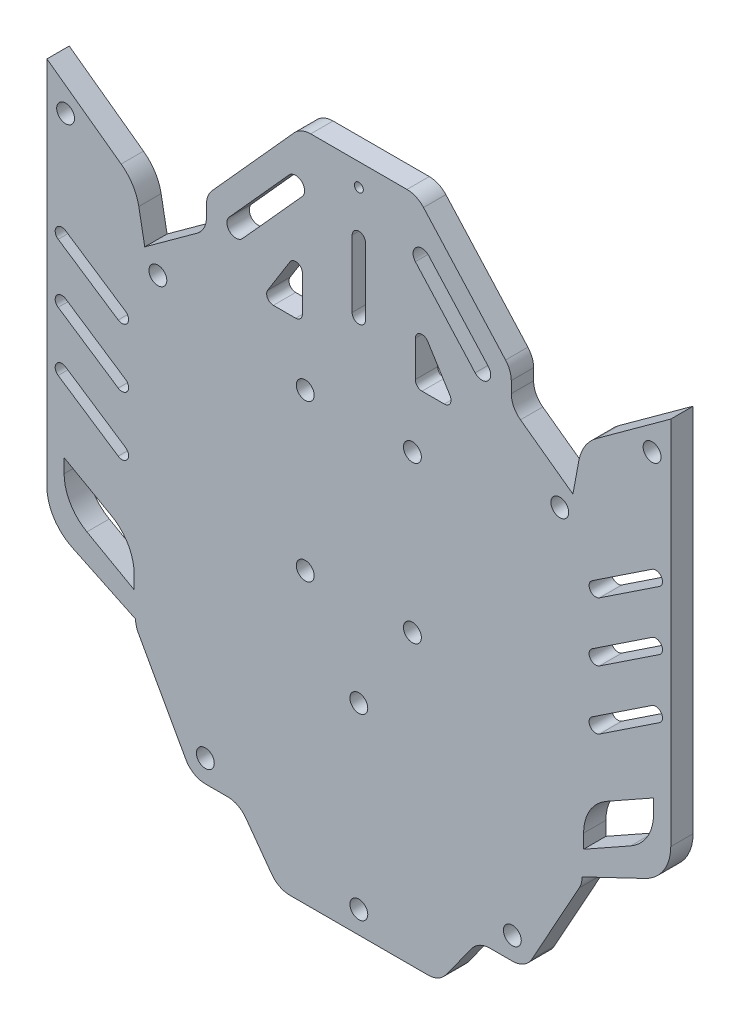
from build123d import *

# Parameters (mm, degrees)
SKETCH2_R           = 1
SKETCH2_R_2         = 2
BOSS_EXTRUDE2_DEPTH = 5


with BuildPart() as part:
    # Sketch2 → Boss-Extrude2 (new body)
    with BuildSketch(Plane.XY):
        with BuildLine():
            Line((10.773856573, 0), (-10.773856573, 0))
            ThreePointArc((-10.773856573, 0), (-12.807539789, -0.432272712), (-14.489580701, -1.654346968))
            Line((-14.489580701, -1.654346968), (-32.85230533, -22.048218747))
            ThreePointArc((-32.85230533, -22.048218747), (-33.804483335, -23.602032031), (-34.136581202, -25.393871779))
            Line((-34.136581202, -25.393871779), (-34.136581202, -27.926924356))
            ThreePointArc((-34.136581202, -27.926924356), (-34.681548581, -30.196876855), (-36.197654941, -31.972009328))
            Line((-36.197654941, -31.972009328), (-47.938926261, -40.502542276))
            Line((-47.938926261, -40.502542276), (-49.271172991, -33.33925419))
            ThreePointArc((-49.271172991, -33.33925419), (-50.646968461, -29.828950283), (-53.224733986, -27.077555801))
            Line((-53.224733986, -27.077555801), (-69.848063434, -15))
            Line((-69.848063434, -15), (-69.848063434, -97.913369077))
            ThreePointArc((-69.848063434, -97.913369077), (-68.307820915, -103.245582818), (-64.161562759, -106.935216093))
            Line((-64.161562759, -106.935216093), (-50, -113.7061014))
            ThreePointArc((-50, -113.7061014), (-49.840547901, -114.95873703), (-49.372361591, -116.131478508))
            Line((-49.372361591, -116.131478508), (-38.744938669, -135.290122192))
            ThreePointArc((-38.744938669, -135.290122192), (-36.909614174, -137.173276478), (-34.372577077, -137.864745084))
            Line((-34.372577077, -137.864745084), (-29.364406032, -137.864745084))
            ThreePointArc((-29.364406032, -137.864745084), (-27.094453533, -138.409712463), (-25.31932106, -139.925818823))
            Line((-25.31932106, -139.925818823), (-19.497457724, -147.938926261))
            ThreePointArc((-19.497457724, -147.938926261), (-17.722325251, -149.455032621), (-15.452372753, -150))
            Line((-15.452372753, -150), (15.452372753, -150))
            ThreePointArc((15.452372753, -150), (17.722325251, -149.455032621), (19.497457724, -147.938926261))
            Line((19.497457724, -147.938926261), (25.31932106, -139.925818823))
            ThreePointArc((25.31932106, -139.925818823), (27.094453533, -138.409712463), (29.364406032, -137.864745084))
            Line((29.364406032, -137.864745084), (34.372577077, -137.864745084))
            ThreePointArc((34.372577077, -137.864745084), (36.909614174, -137.173276478), (38.744938669, -135.290122192))
            Line((38.744938669, -135.290122192), (49.372361591, -116.131478508))
            ThreePointArc((49.372361591, -116.131478508), (49.840547901, -114.95873703), (50, -113.7061014))
            Line((50, -113.7061014), (64.161562759, -106.935216093))
            ThreePointArc((64.161562759, -106.935216093), (68.307820915, -103.245582818), (69.848063434, -97.913369077))
            Line((69.848063434, -97.913369077), (69.848063434, -15))
            Line((69.848063434, -15), (53.224733986, -27.077555801))
            ThreePointArc((53.224733986, -27.077555801), (50.646968461, -29.828950283), (49.271172991, -33.33925419))
            Line((49.271172991, -33.33925419), (47.938926261, -40.502542276))
            Line((47.938926261, -40.502542276), (36.197654941, -31.972009328))
            ThreePointArc((36.197654941, -31.972009328), (34.681548581, -30.196876855), (34.136581202, -27.926924356))
            Line((34.136581202, -27.926924356), (34.136581202, -25.393871779))
            ThreePointArc((34.136581202, -25.393871779), (33.804483335, -23.602032031), (32.85230533, -22.048218747))
            Line((32.85230533, -22.048218747), (14.489580701, -1.654346968))
            ThreePointArc((14.489580701, -1.654346968), (12.807539789, -0.432272712), (10.773856573, 0))
        make_face()
        with Locations((0, -5)):
            Circle(SKETCH2_R, mode=Mode.SUBTRACT)
        with Locations((0, -145)):
            Circle(SKETCH2_R_2, mode=Mode.SUBTRACT)
        with Locations((0, -105)):
            Circle(SKETCH2_R_2, mode=Mode.SUBTRACT)
        with Locations((-12, -50.308044585)):
            Circle(SKETCH2_R_2, mode=Mode.SUBTRACT)
        with Locations((12, -50.308044585)):
            Circle(SKETCH2_R_2, mode=Mode.SUBTRACT)
        with Locations((12, -85.308044585)):
            Circle(SKETCH2_R_2, mode=Mode.SUBTRACT)
        with Locations((-12, -85.308044585)):
            Circle(SKETCH2_R_2, mode=Mode.SUBTRACT)
        with Locations((-34.372577077, -132.864745084)):
            Circle(SKETCH2_R_2, mode=Mode.SUBTRACT)
        with Locations((34.372577077, -132.864745084)):
            Circle(SKETCH2_R_2, mode=Mode.SUBTRACT)
        with Locations((-45, -44.547627247)):
            Circle(SKETCH2_R_2, mode=Mode.SUBTRACT)
        with Locations((45, -44.547627247)):
            Circle(SKETCH2_R_2, mode=Mode.SUBTRACT)
        with Locations((-65.664848414, -23.474551604)):
            Circle(SKETCH2_R_2, mode=Mode.SUBTRACT)
        with Locations((65.664848414, -23.474551604)):
            Circle(SKETCH2_R_2, mode=Mode.SUBTRACT)
        with BuildLine():
            Line((-12.660728973, -13.073490301), (-26.043341101, -27.93638681))
            ThreePointArc((-26.043341101, -27.93638681), (-28.867891964, -28.084415248), (-29.015920402, -25.259864385))
            Line((-29.015920402, -25.259864385), (-15.633308275, -10.396967875))
            ThreePointArc((-15.633308275, -10.396967875), (-12.808757412, -10.248939437), (-12.660728973, -13.073490301))
        make_face(mode=Mode.SUBTRACT)
        with BuildLine():
            Line((14.147018624, -37.43638681), (19.147018624, -37.43638681))
            ThreePointArc((19.147018624, -37.43638681), (20.458982346, -36.663539609), (20.41901608, -35.1413884))
            Line((20.41901608, -35.1413884), (15.41901608, -27.1413884))
            ThreePointArc((15.41901608, -27.1413884), (13.733494855, -26.494513691), (12.647018624, -27.93638681))
            Line((12.647018624, -27.93638681), (12.647018624, -35.93638681))
            ThreePointArc((12.647018624, -35.93638681), (13.086358453, -36.997046982), (14.147018624, -37.43638681))
        make_face(mode=Mode.SUBTRACT)
        with BuildLine():
            Line((-14.147018624, -37.43638681), (-19.147018624, -37.43638681))
            ThreePointArc((-19.147018624, -37.43638681), (-20.458982346, -36.663539609), (-20.41901608, -35.1413884))
            Line((-20.41901608, -35.1413884), (-15.41901608, -27.1413884))
            ThreePointArc((-15.41901608, -27.1413884), (-13.733494855, -26.494513691), (-12.647018624, -27.93638681))
            Line((-12.647018624, -27.93638681), (-12.647018624, -35.93638681))
            ThreePointArc((-12.647018624, -35.93638681), (-13.086358453, -36.997046982), (-14.147018624, -37.43638681))
        make_face(mode=Mode.SUBTRACT)
        with BuildLine():
            Line((12.660728973, -13.073490301), (26.043341101, -27.93638681))
            ThreePointArc((26.043341101, -27.93638681), (28.867891964, -28.084415248), (29.015920402, -25.259864385))
            Line((29.015920402, -25.259864385), (15.633308275, -10.396967875))
            ThreePointArc((15.633308275, -10.396967875), (12.808757412, -10.248939437), (12.660728973, -13.073490301))
        make_face(mode=Mode.SUBTRACT)
        with BuildLine():
            Line((1.5, -15), (1.5, -30))
            ThreePointArc((1.5, -30), (0, -31.5), (-1.5, -30))
            Line((-1.5, -30), (-1.5, -15))
            ThreePointArc((-1.5, -15), (0, -13.5), (1.5, -15))
        make_face(mode=Mode.SUBTRACT)
        with BuildLine():
            Line((-65.664848414, -46.221025879), (-52.228109947, -55.148662815))
            ThreePointArc((-52.228109947, -55.148662815), (-51.808846465, -57.228138261), (-53.888321911, -57.647401744))
            Line((-53.888321911, -57.647401744), (-67.325060378, -48.719764808))
            ThreePointArc((-67.325060378, -48.719764808), (-67.744323861, -46.640289361), (-65.664848414, -46.221025879))
        make_face(mode=Mode.SUBTRACT)
        with BuildLine():
            Line((-65.664848414, -59.427687694), (-52.228109947, -68.35532463))
            ThreePointArc((-52.228109947, -68.35532463), (-51.808846465, -70.434800076), (-53.888321911, -70.854063559))
            Line((-53.888321911, -70.854063559), (-67.325060378, -61.926426623))
            ThreePointArc((-67.325060378, -61.926426623), (-67.744323861, -59.846951176), (-65.664848414, -59.427687694))
        make_face(mode=Mode.SUBTRACT)
        with BuildLine():
            Line((-65.664848414, -72.634349509), (-52.228109947, -81.561986445))
            ThreePointArc((-52.228109947, -81.561986445), (-51.808846465, -83.641461891), (-53.888321911, -84.060725374))
            Line((-53.888321911, -84.060725374), (-67.325060378, -75.133088438))
            ThreePointArc((-67.325060378, -75.133088438), (-67.744323861, -73.053612992), (-65.664848414, -72.634349509))
        make_face(mode=Mode.SUBTRACT)
        with BuildLine():
            Line((-50.329634754, -108.179131466), (-60.893208182, -102.243321386))
            ThreePointArc((-60.893208182, -102.243321386), (-64.625452121, -98.575764145), (-65.994483169, -93.525380502))
            Line((-65.994483169, -93.525380502), (-65.994483169, -90.405290348))
            Line((-65.994483169, -90.405290348), (-55.430909741, -96.341100429))
            ThreePointArc((-55.430909741, -96.341100429), (-51.698665801, -100.00865767), (-50.329634754, -105.059041312))
            Line((-50.329634754, -105.059041312), (-50.329634754, -108.179131466))
        make_face(mode=Mode.SUBTRACT)
        with BuildLine():
            Line((65.664848414, -46.221025879), (52.228109947, -55.148662815))
            ThreePointArc((52.228109947, -55.148662815), (51.808846465, -57.228138261), (53.888321911, -57.647401744))
            Line((53.888321911, -57.647401744), (67.325060378, -48.719764808))
            ThreePointArc((67.325060378, -48.719764808), (67.744323861, -46.640289361), (65.664848414, -46.221025879))
        make_face(mode=Mode.SUBTRACT)
        with BuildLine():
            Line((65.664848414, -59.427687694), (52.228109947, -68.35532463))
            ThreePointArc((52.228109947, -68.35532463), (51.808846465, -70.434800076), (53.888321911, -70.854063559))
            Line((53.888321911, -70.854063559), (67.325060378, -61.926426623))
            ThreePointArc((67.325060378, -61.926426623), (67.744323861, -59.846951176), (65.664848414, -59.427687694))
        make_face(mode=Mode.SUBTRACT)
        with BuildLine():
            Line((65.664848414, -72.634349509), (52.228109947, -81.561986445))
            ThreePointArc((52.228109947, -81.561986445), (51.808846465, -83.641461891), (53.888321911, -84.060725374))
            Line((53.888321911, -84.060725374), (67.325060378, -75.133088438))
            ThreePointArc((67.325060378, -75.133088438), (67.744323861, -73.053612992), (65.664848414, -72.634349509))
        make_face(mode=Mode.SUBTRACT)
        with BuildLine():
            Line((65.994483169, -90.405290348), (55.430909741, -96.341100429))
            ThreePointArc((55.430909741, -96.341100429), (51.698665801, -100.00865767), (50.329634754, -105.059041312))
            Line((50.329634754, -105.059041312), (50.329634754, -108.179131466))
            Line((50.329634754, -108.179131466), (60.893208182, -102.243321386))
            ThreePointArc((60.893208182, -102.243321386), (64.625452121, -98.575764145), (65.994483169, -93.525380502))
            Line((65.994483169, -93.525380502), (65.994483169, -90.405290348))
        make_face(mode=Mode.SUBTRACT)
    extrude(amount=BOSS_EXTRUDE2_DEPTH)


solid = part.part
